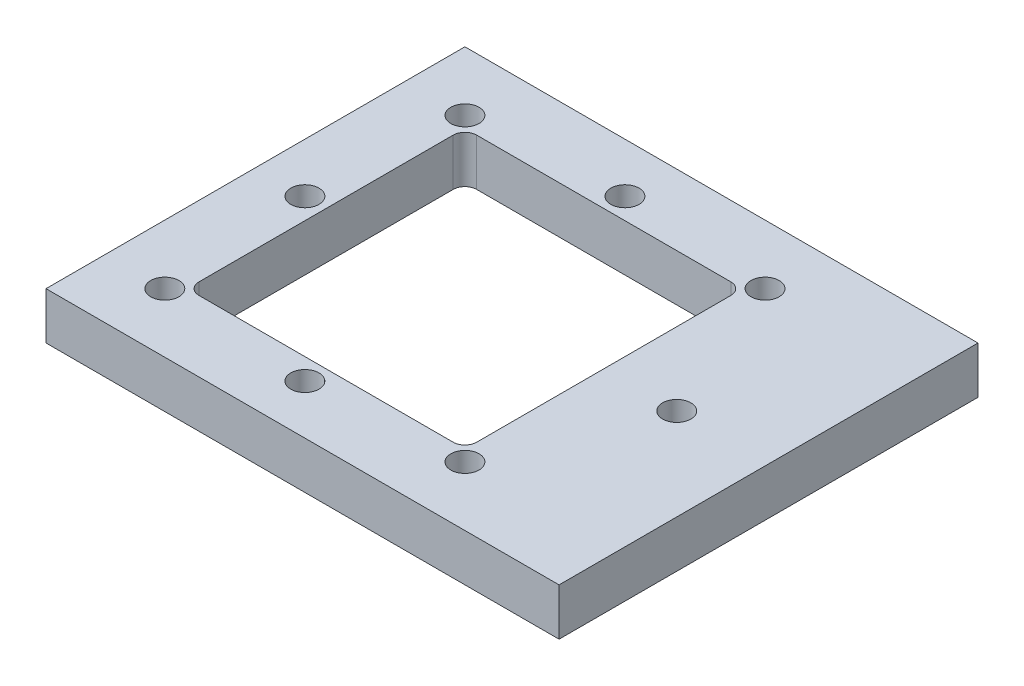
from build123d import *

# Parameters (mm, degrees)
SKETCH_1_W          = 54.5
SKETCH_1_H          = 44.5
EXTRUDE_1_DEPTH     = 5
SKETCH_2_W          = 29.5
SKETCH_2_H          = 29.5
CUT_EXTRUDE_1_DEPTH = 71.537224215
FILLET_1_R          = 1.25
SKETCH_4_R          = 1.5
CUT_EXTRUDE_2_DEPTH = 71.537224215
SKETCH_7_R          = 1.5
CUT_EXTRUDE_3_DEPTH = 71.537224215


with BuildPart() as part:
    # Эскиз1 → Бобышка-Вытянуть1 (new body)
    with BuildSketch(Plane(origin=(0, 0, 0), x_dir=(1, 0, 0), z_dir=(0, 1, 0))):
        with Locations((27.25, 22.25)):
            Rectangle(SKETCH_1_W, SKETCH_1_H)
    extrude(amount=EXTRUDE_1_DEPTH)

    # Эскиз2 → Вырез-Вытянуть1 (cut, through all)
    with BuildSketch(Plane(origin=(0, 5, 0), x_dir=(1, 0, 0), z_dir=(0, 1, 0))):
        with Locations((22.25, 22.25)):
            Rectangle(SKETCH_2_W, SKETCH_2_H)
    extrude(amount=-CUT_EXTRUDE_1_DEPTH, mode=Mode.SUBTRACT)

    # Скругление1
    fillet_1_edges = [part.edges().sort_by_distance(p)[0] for p in [
        (7.5, 2.5, -7.5),
        (7.5, 2.5, -37),
        (37, 2.5, -37),
        (37, 2.5, -7.5),
    ]]
    fillet(fillet_1_edges, radius=FILLET_1_R)

    # Эскиз4 → Вырез-Вытянуть2 (cut, through all)
    with BuildSketch(Plane(origin=(0, 5, 0), x_dir=(1, 0, 0), z_dir=(0, 1, 0))):
        with Locations(Location((44.75, 22.25, 0), (0, 0, 270))):
            Circle(SKETCH_4_R)
    extrude(amount=-CUT_EXTRUDE_2_DEPTH, mode=Mode.SUBTRACT)

    # Эскиз7 → Вырез-Вытянуть3 (cut, through all)
    with BuildSketch(Plane.XZ):
        with Locations(Location((6.310660172, -38.189339828, 0), (0, 0, 270))):
            Circle(SKETCH_7_R)
        with Locations(Location((38.189339828, -38.189339828, 0), (0, 0, 270))):
            Circle(SKETCH_7_R)
        with Locations(Location((6.310660172, -6.310660172, 0), (0, 0, 270))):
            Circle(SKETCH_7_R)
        with Locations(Location((38.189339828, -6.310660172, 0), (0, 0, 270))):
            Circle(SKETCH_7_R)
        with Locations(Location((22.25, -39.25, 0), (0, 0, 270))):
            Circle(SKETCH_7_R)
        with Locations(Location((5.25, -22.25, 0), (0, 0, 270))):
            Circle(SKETCH_7_R)
        with Locations(Location((22.25, -5.25, 0), (0, 0, 90))):
            Circle(SKETCH_7_R)
    extrude(amount=-CUT_EXTRUDE_3_DEPTH, mode=Mode.SUBTRACT)


solid = part.part
